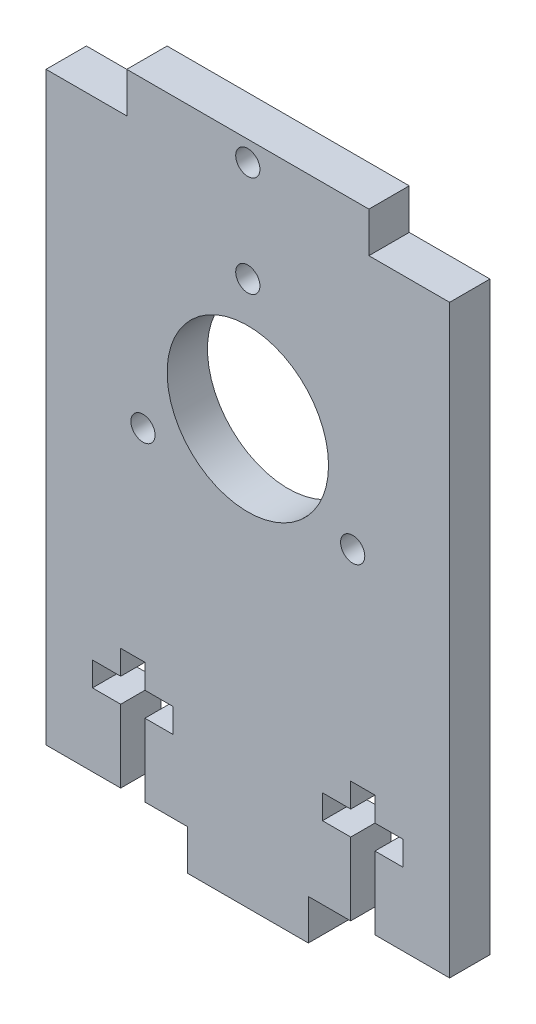
from build123d import *

# Parameters (mm, degrees)
CROQUIS1_R              = 1.5
CROQUIS1_R_2            = 10
SALIENTE_EXTRUIR1_DEPTH = 5


with BuildPart() as part:
    # Croquis1 → Saliente-Extruir1 (new body)
    with BuildSketch(Plane.XY):
        Polygon((0, 0), (9.25, 0), (9.25, 9), (5.75, 9), (5.75, 12), (9.25, 12), (9.25, 15), (12.25, 15), (12.25, 12), (15.75, 12), (15.75, 9), (12.25, 9), (12.25, 0), (17.5, 0), (17.5, -5), (32.5, -5), (32.5, 0), (37.75, 0), (37.75, 9), (34.25, 9), (34.25, 12), (37.75, 12), (37.75, 15), (40.75, 15), (40.75, 12), (44.25, 12), (44.25, 9), (40.75, 9), (40.75, 0), (50, 0), (50, 72.5), (40, 72.5), (40, 77.5), (10, 77.5), (10, 72.5), (0, 72.5), align=None)
        with Locations((25, 75)):
            Circle(CROQUIS1_R, mode=Mode.SUBTRACT)
        with Locations((25, 47.5)):
            Circle(CROQUIS1_R_2, mode=Mode.SUBTRACT)
        with Locations((25, 62.5)):
            Circle(CROQUIS1_R, mode=Mode.SUBTRACT)
        with Locations((37.990381057, 40)):
            Circle(CROQUIS1_R, mode=Mode.SUBTRACT)
        with Locations((12.009618943, 40)):
            Circle(CROQUIS1_R, mode=Mode.SUBTRACT)
    extrude(amount=SALIENTE_EXTRUIR1_DEPTH)


solid = part.part
